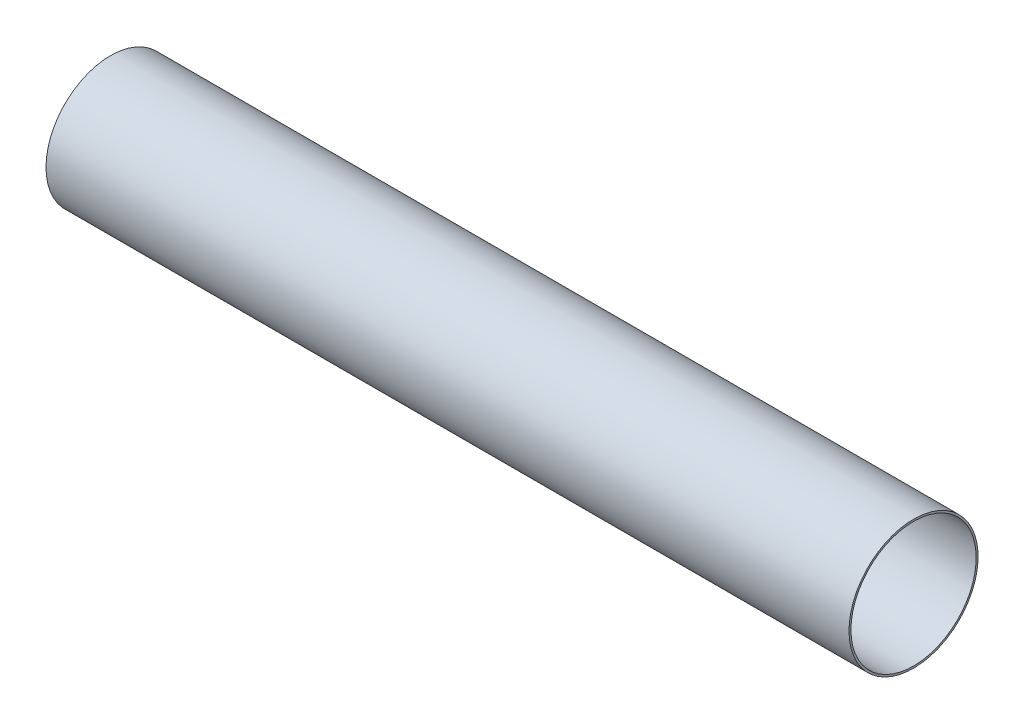
from build123d import *

# Parameters (mm, degrees)
SKETCH1_R           = 51.054
SKETCH1_R_2         = 49.53
BOSS_EXTRUDE1_DEPTH = 635


with BuildPart() as part:
    # Sketch1 → Boss-Extrude1 (new body)
    with BuildSketch(Plane.YZ):
        with Locations(Location((0, 0, 0), (0, 0, 90))):
            Circle(SKETCH1_R)
        with Locations(Location((0, 0, 0), (0, 0, 90))):
            Circle(SKETCH1_R_2, mode=Mode.SUBTRACT)
    extrude(amount=BOSS_EXTRUDE1_DEPTH)


solid = part.part
